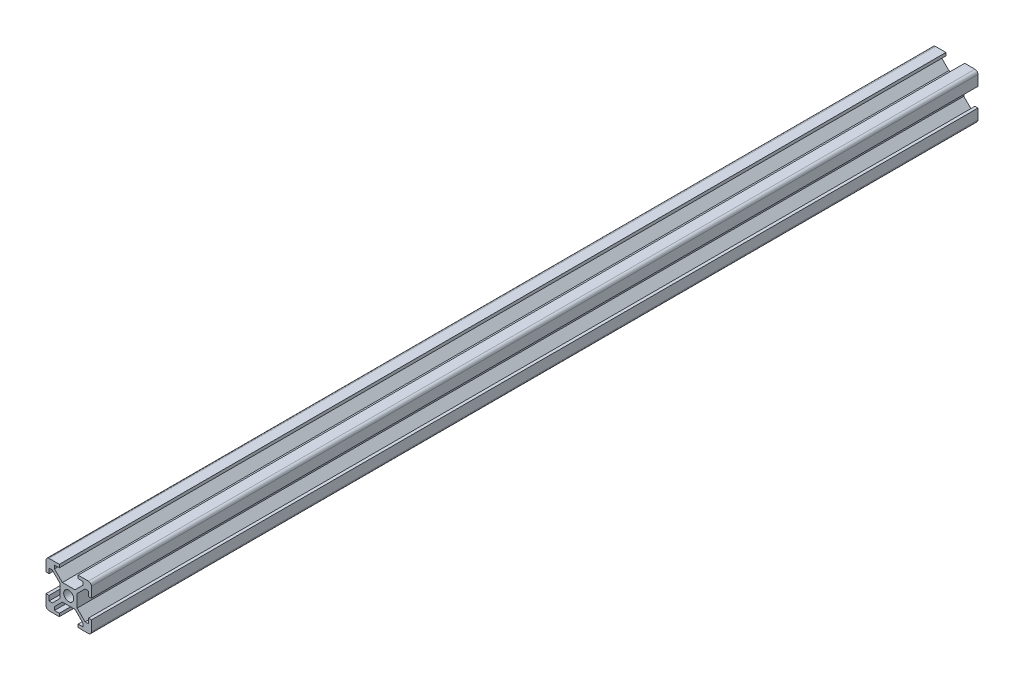
from build123d import *

# Parameters (mm, degrees)
SKETCH_2_R      = 1.65
EXTRUDE_1_DEPTH = 146.5


with BuildPart() as part:
    # 草图2 → 凸台-拉伸1 (new, symmetric)
    with BuildSketch(Plane.XY):
        with BuildLine():
            Line((-2.092893219, -2.8), (-4.7, -5.407106781))
            Line((-4.7, -5.407106781), (-4.7, -6.5))
            Line((-4.7, -6.5), (-3.1, -6.5))
            Line((-3.1, -6.5), (-3.1, -7.5))
            Line((-3.1, -7.5), (-6.5, -7.5))
            ThreePointArc((-6.5, -7.5), (-7.207106781, -7.207106781), (-7.5, -6.5))
            Line((-7.5, -6.5), (-7.5, -3.1))
            Line((-7.5, -3.1), (-6.5, -3.1))
            Line((-6.5, -3.1), (-6.5, -4.7))
            Line((-6.5, -4.7), (-5.407106781, -4.7))
            Line((-5.407106781, -4.7), (-2.8, -2.092893219))
            Line((-2.8, -2.092893219), (-2.8, 2.092893219))
            Line((-2.8, 2.092893219), (-5.407106781, 4.7))
            Line((-5.407106781, 4.7), (-6.5, 4.7))
            Line((-6.5, 4.7), (-6.5, 3.1))
            Line((-6.5, 3.1), (-7.5, 3.1))
            Line((-7.5, 3.1), (-7.5, 6.5))
            ThreePointArc((-7.5, 6.5), (-7.207106781, 7.207106781), (-6.5, 7.5))
            Line((-6.5, 7.5), (-3.1, 7.5))
            Line((-3.1, 7.5), (-3.1, 6.5))
            Line((-3.1, 6.5), (-4.7, 6.5))
            Line((-4.7, 6.5), (-4.7, 5.407106781))
            Line((-4.7, 5.407106781), (-2.092893219, 2.8))
            Line((-2.092893219, 2.8), (2.092893219, 2.8))
            Line((2.092893219, 2.8), (4.7, 5.407106781))
            Line((4.7, 5.407106781), (4.7, 6.5))
            Line((4.7, 6.5), (3.1, 6.5))
            Line((3.1, 6.5), (3.1, 7.5))
            Line((3.1, 7.5), (6.5, 7.5))
            ThreePointArc((6.5, 7.5), (7.207106781, 7.207106781), (7.5, 6.5))
            Line((7.5, 6.5), (7.5, 3.1))
            Line((7.5, 3.1), (6.5, 3.1))
            Line((6.5, 3.1), (6.5, 4.7))
            Line((6.5, 4.7), (5.407106781, 4.7))
            Line((5.407106781, 4.7), (2.8, 2.092893219))
            Line((2.8, 2.092893219), (2.8, -2.092893219))
            Line((2.8, -2.092893219), (5.407106781, -4.7))
            Line((5.407106781, -4.7), (6.5, -4.7))
            Line((6.5, -4.7), (6.5, -3.1))
            Line((6.5, -3.1), (7.5, -3.1))
            Line((7.5, -3.1), (7.5, -6.5))
            ThreePointArc((7.5, -6.5), (7.207106781, -7.207106781), (6.5, -7.5))
            Line((6.5, -7.5), (3.1, -7.5))
            Line((3.1, -7.5), (3.1, -6.5))
            Line((3.1, -6.5), (4.7, -6.5))
            Line((4.7, -6.5), (4.7, -5.407106781))
            Line((4.7, -5.407106781), (2.092893219, -2.8))
            Line((2.092893219, -2.8), (-2.092893219, -2.8))
        make_face()
        Circle(SKETCH_2_R, mode=Mode.SUBTRACT)
    extrude(amount=EXTRUDE_1_DEPTH, both=True)


solid = part.part
